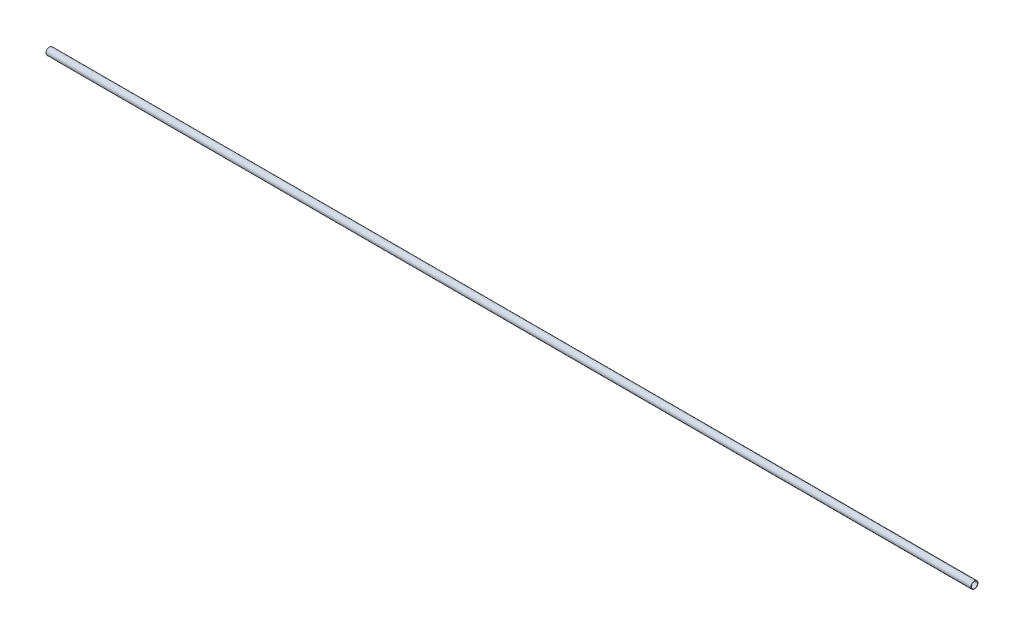
from build123d import *

# Parameters (mm, degrees)
SKETCH3_R           = 11.7094
SKETCH3_R_2         = 10.4648
BOSS_EXTRUDE1_DEPTH = 3048


with BuildPart() as part:
    # Sketch3 → Boss-Extrude1 (new body)
    with BuildSketch(Plane(origin=(0, 0, 0), x_dir=(0, 0, -1), z_dir=(1, 0, 0))):
        Circle(SKETCH3_R)
        Circle(SKETCH3_R_2, mode=Mode.SUBTRACT)
    extrude(amount=BOSS_EXTRUDE1_DEPTH)


solid = part.part
